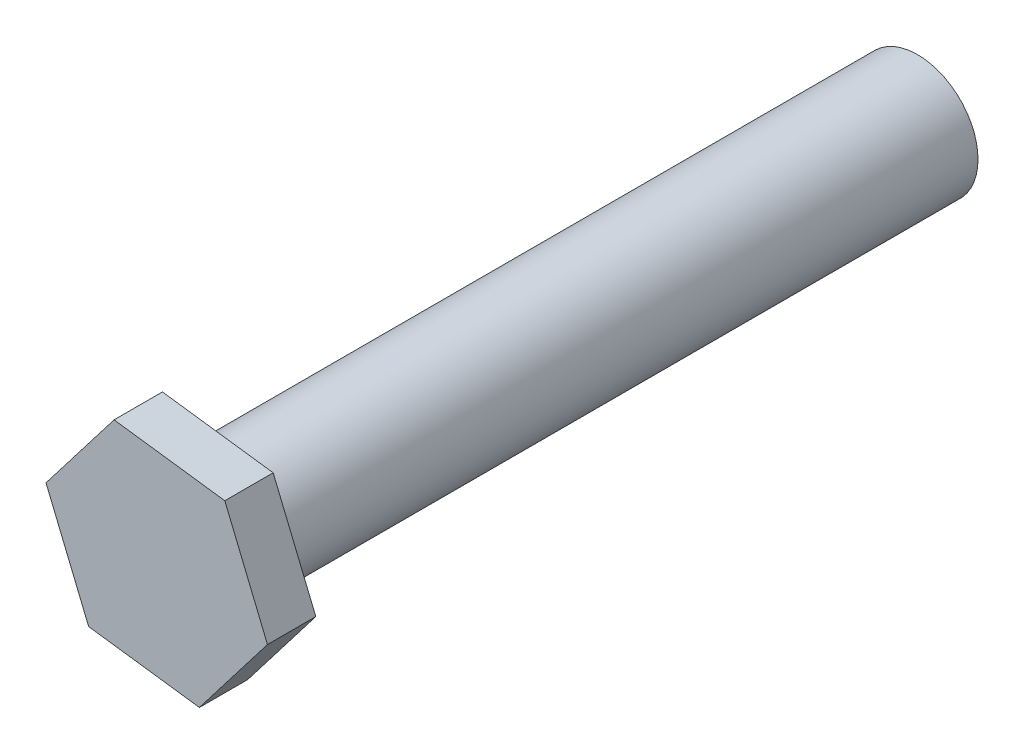
from build123d import *

# Parameters (mm, degrees)
BOSS_EXTRUDE1_DEPTH      = 260
BOSS_EXTRUDE1_DEPTH_BACK = 34.6
SKETCH2_R                = 25
BOSS_EXTRUDE2_DEPTH      = 20


with BuildPart() as part:
    # Sketch2 → Boss-Extrude1 (new, two sides: drawn at the far end of the back side and taken through both)
    with BuildSketch(Plane.XY.offset(-BOSS_EXTRUDE1_DEPTH_BACK)):
        Circle(SKETCH2_R)
    extrude(amount=BOSS_EXTRUDE1_DEPTH + BOSS_EXTRUDE1_DEPTH_BACK)

    # Sketch3 → Boss-Extrude2 (add)
    with BuildSketch(Plane.XY.offset(260)):
        Polygon((28.148127082, 36.619889064), (-17.639690672, 42.686937654), (-45.787817755, 6.06704859), (-28.148127082, -36.619889064), (17.639690672, -42.686937654), (45.787817755, -6.06704859), align=None)
    extrude(amount=BOSS_EXTRUDE2_DEPTH)


solid = part.part
